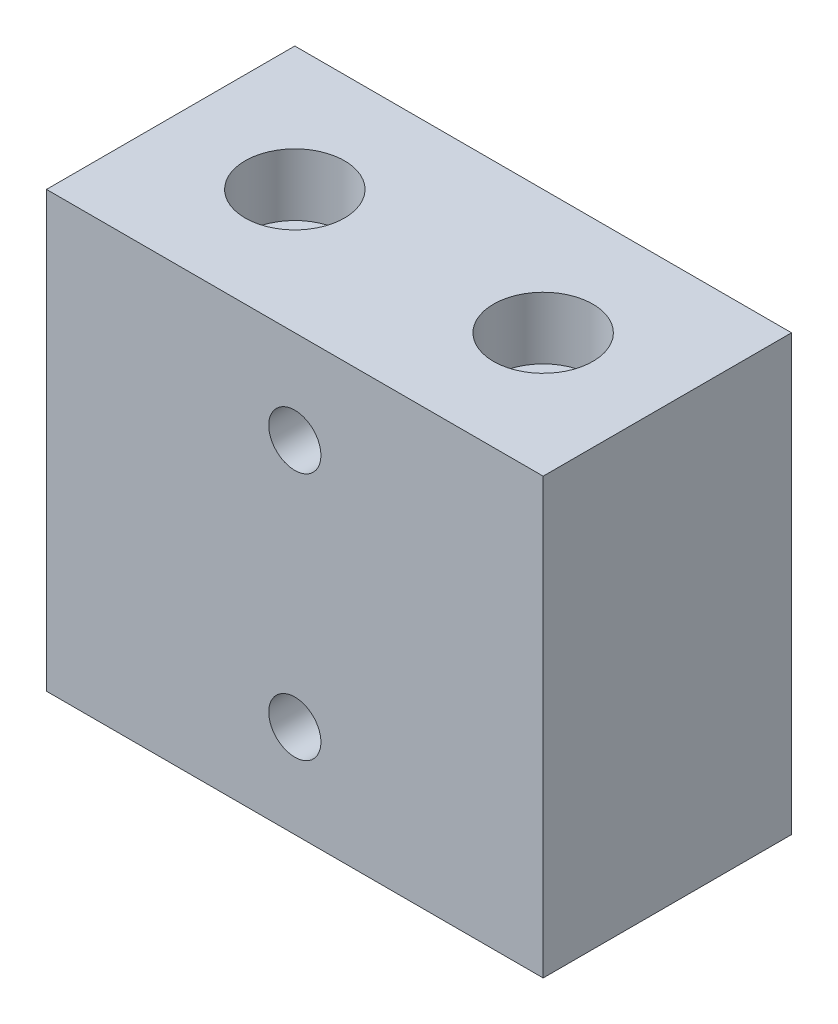
from build123d import *

# Parameters (mm, degrees)
SKETCH1_W           = 40
SKETCH1_H           = 20
SKETCH1_R           = 2.5
BOSS_EXTRUDE1_DEPTH = 35
SKETCH2_R           = 4
CUT_EXTRUDE1_DEPTH  = 5
SKETCH3_R           = 2.1
CUT_EXTRUDE2_DEPTH  = 46


with BuildPart() as part:
    # Sketch1 → Boss-Extrude1 (new body)
    with BuildSketch(Plane(origin=(0, 0, 0), x_dir=(1, 0, 0), z_dir=(0, 1, 0))):
        Rectangle(SKETCH1_W, SKETCH1_H)
        with Locations(Location((-10, 0, 0), (0, 0, 270))):
            Circle(SKETCH1_R, mode=Mode.SUBTRACT)
        with Locations(Location((10, 0, 0), (0, 0, 270))):
            Circle(SKETCH1_R, mode=Mode.SUBTRACT)
    extrude(amount=BOSS_EXTRUDE1_DEPTH)

    # Sketch2 → Cut-Extrude1 (cut)
    with BuildSketch(Plane(origin=(0, 35, 0), x_dir=(1, 0, 0), z_dir=(0, 1, 0))):
        with Locations(Location((-10, 0, 0), (0, 0, 270))):
            Circle(SKETCH2_R)
        with Locations(Location((10, 0, 0), (0, 0, 270))):
            Circle(SKETCH2_R)
    extrude(amount=-CUT_EXTRUDE1_DEPTH, mode=Mode.SUBTRACT)

    # Sketch3 → Cut-Extrude2 (cut, through all)
    with BuildSketch(Plane.XY.offset(10)):
        with Locations((0, 27.5)):
            Circle(SKETCH3_R)
        with Locations((0, 7.5)):
            Circle(SKETCH3_R)
    extrude(amount=-CUT_EXTRUDE2_DEPTH, mode=Mode.SUBTRACT)


solid = part.part
